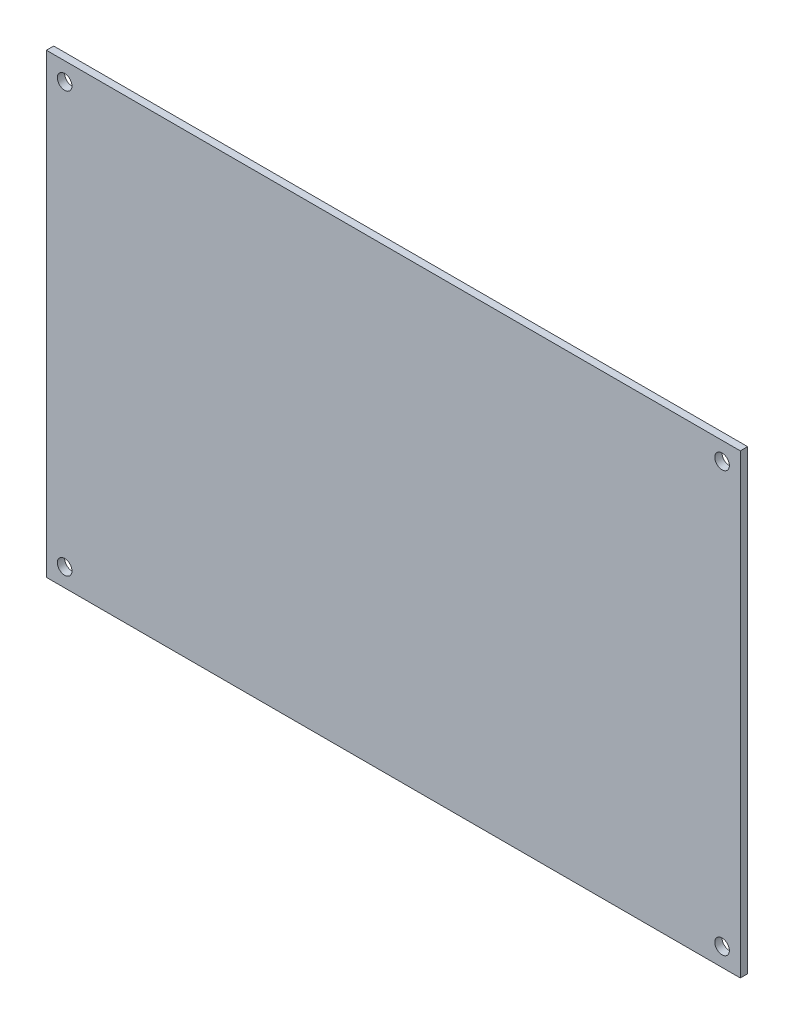
from build123d import *

# Parameters (mm, degrees)
SKETCH_1_W      = 380
SKETCH_1_H      = 250
SKETCH_1_R      = 4
EXTRUDE_1_DEPTH = 4


with BuildPart() as part:
    # 草图1 → 凸台-拉伸1 (new body)
    with BuildSketch(Plane.XY):
        with Locations((190, 125)):
            Rectangle(SKETCH_1_W, SKETCH_1_H)
        with Locations((10, 240)):
            Circle(SKETCH_1_R, mode=Mode.SUBTRACT)
        with Locations((370, 240)):
            Circle(SKETCH_1_R, mode=Mode.SUBTRACT)
        with Locations((370, 10)):
            Circle(SKETCH_1_R, mode=Mode.SUBTRACT)
        with Locations((10, 10)):
            Circle(SKETCH_1_R, mode=Mode.SUBTRACT)
    extrude(amount=EXTRUDE_1_DEPTH)


solid = part.part
